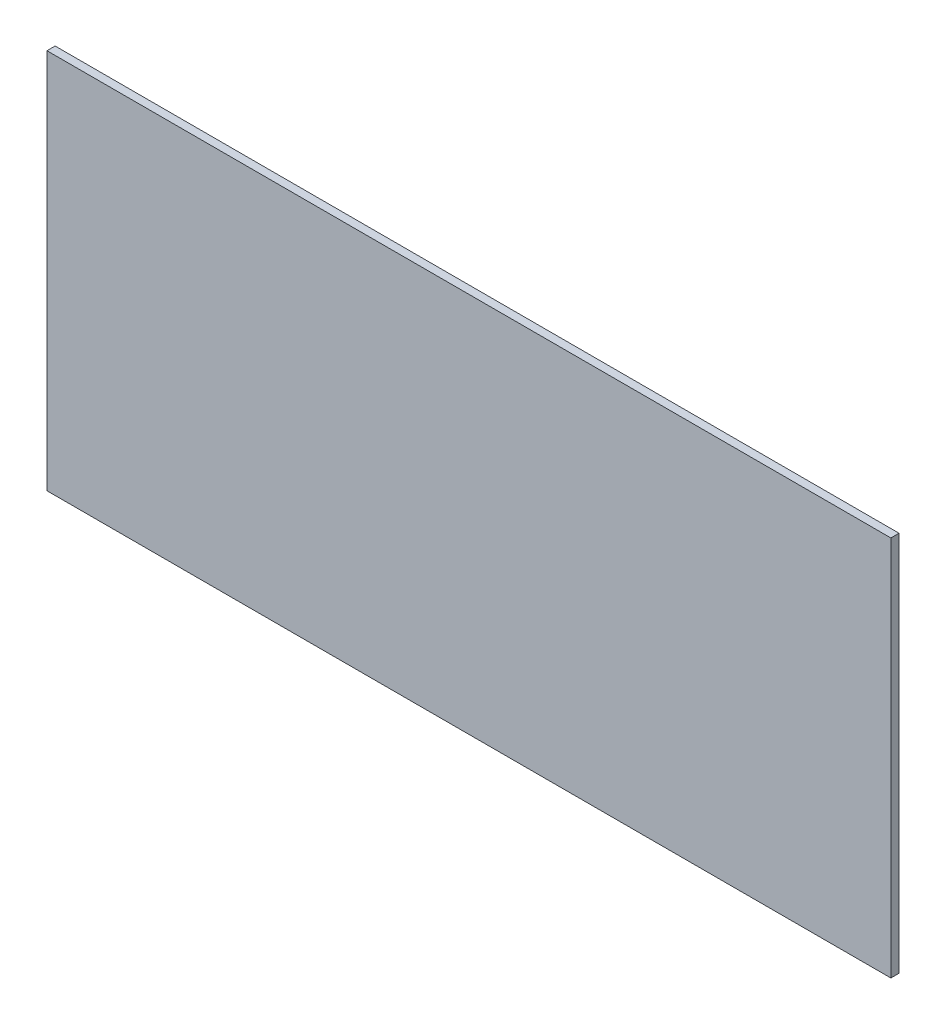
from build123d import *

# Parameters (mm, degrees)
SKIZZE1_W                       = 310
SKIZZE1_H                       = 140
AUFSATZ_LINEAR_AUSTRAGEN1_DEPTH = 3


with BuildPart() as part:
    # Skizze1 → Aufsatz-Linear austragen1 (new body)
    with BuildSketch(Plane.XY):
        Rectangle(SKIZZE1_W, SKIZZE1_H)
    extrude(amount=AUFSATZ_LINEAR_AUSTRAGEN1_DEPTH)


solid = part.part
